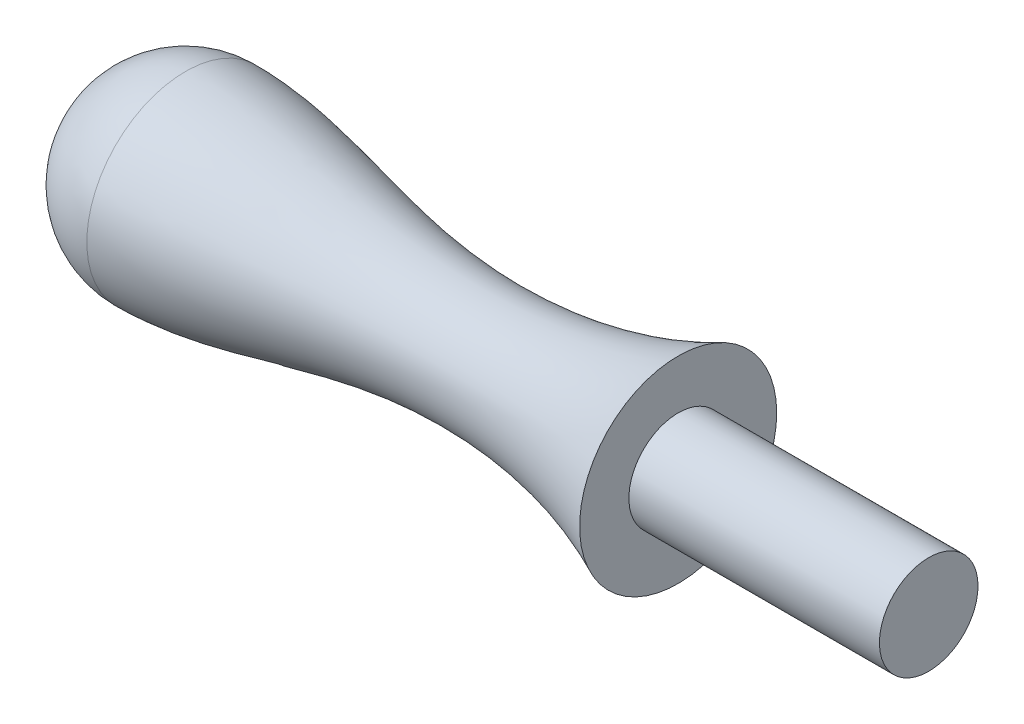
from build123d import *

# Parameters (mm, degrees)
SKETCH2_R           = 3.175
BOSS_EXTRUDE1_DEPTH = 16.143602728


with BuildPart() as part:
    # Sketch1 → Revolve1 (revolve)
    with BuildSketch(Plane(origin=(0, 0, 0), x_dir=(1, 0, 0), z_dir=(0, 1, 0))):
        with BuildLine():
            Line((0, 6.35), (0, 0))
            Line((0, 0), (-31.75, 0))
            Line((-31.75, 0), (-38.1, 0))
            ThreePointArc((-38.1, 0), (-36.240128061, 4.490128061), (-31.75, 6.35))
            add(Edge.make_bspline(
                [(0, 6.35), (-5.750171966, 3.663051231), (-16.893720994, 2.763594688), (-27.170516241, 6.35), (-31.75, 6.35)],
                knots=[0, 0, 0, 0, 0.579529836, 1, 1, 1, 1], degree=3))
        make_face()
    revolve(axis=Axis((0, 0, 0), (-1, 0, 0)))

    # Sketch2 → Boss-Extrude1 (add)
    with BuildSketch(Plane(origin=(0, 0, 0), x_dir=(0, 0, -1), z_dir=(1, 0, 0))):
        Circle(SKETCH2_R)
    extrude(amount=BOSS_EXTRUDE1_DEPTH)


solid = part.part
